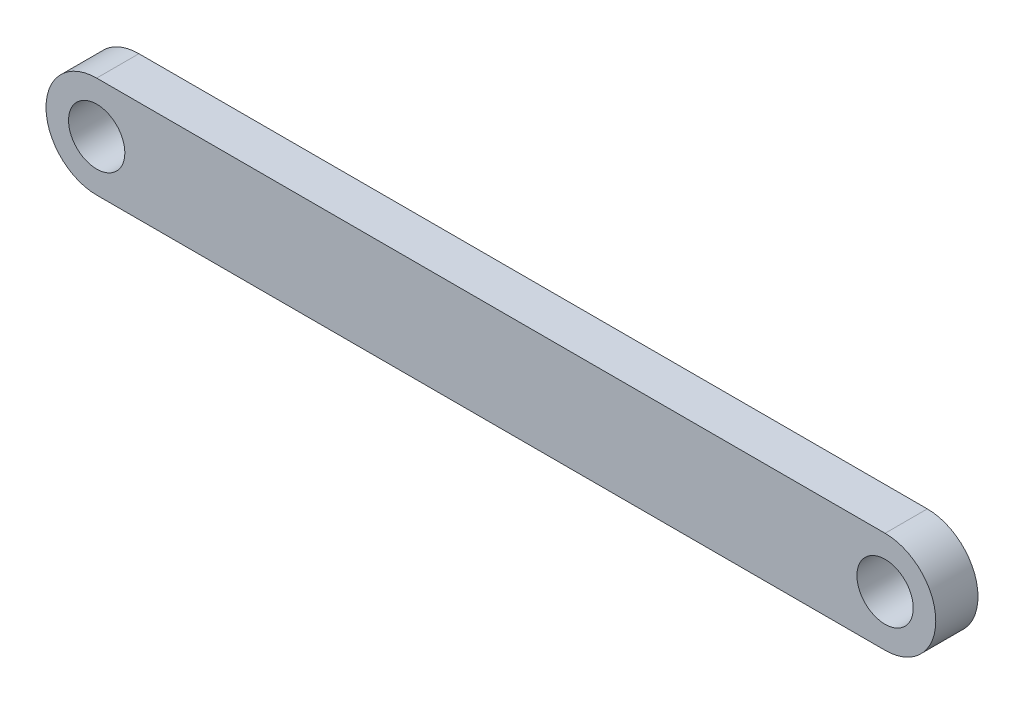
from build123d import *

# Parameters (mm, degrees)
ESQUISSE1_R        = 10
BOSS_EXTRU_1_DEPTH = 15


with BuildPart() as part:
    # Esquisse1 → Boss.-Extru.1 (new body)
    with BuildSketch(Plane.XY):
        with BuildLine():
            Line((-71.174377259, 18), (208.825622741, 18))
            ThreePointArc((208.825622741, 18), (226.825622741, 0), (208.825622741, -18))
            Line((208.825622741, -18), (-71.174377259, -18))
            ThreePointArc((-71.174377259, -18), (-89.174377259, 0), (-71.174377259, 18))
        make_face()
        with Locations((-71.174377259, 0)):
            Circle(ESQUISSE1_R, mode=Mode.SUBTRACT)
        with Locations((208.825622741, 0)):
            Circle(ESQUISSE1_R, mode=Mode.SUBTRACT)
    extrude(amount=BOSS_EXTRU_1_DEPTH)


solid = part.part
